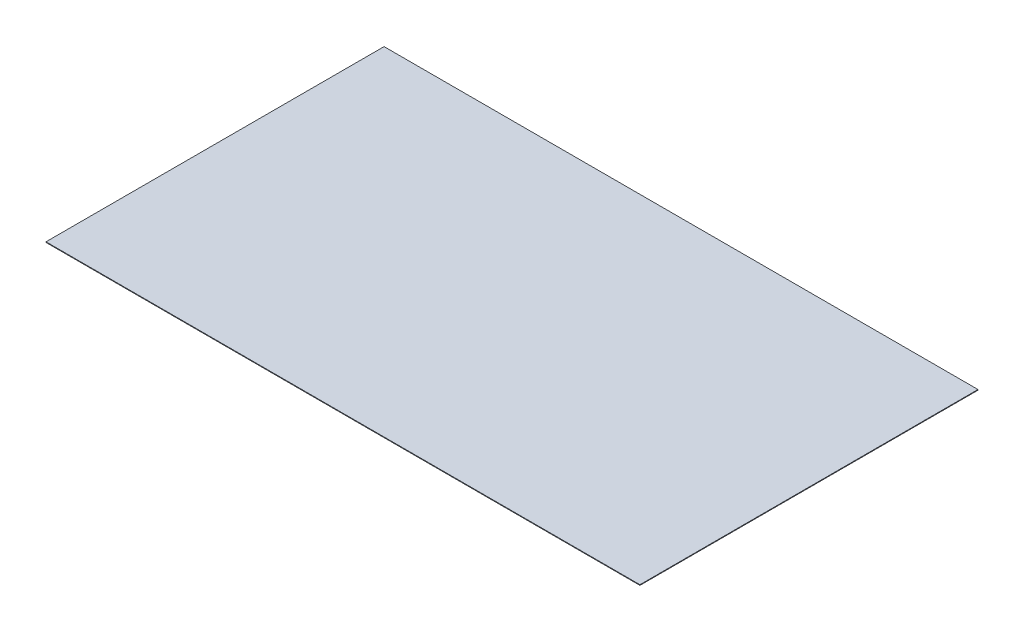
from build123d import *

# Parameters (mm, degrees)
CROQUIS1_W     = 1939.5
CROQUIS1_H     = 1104
EXTRUIR1_DEPTH = 2


with BuildPart() as part:
    # Croquis1 → Extruir1 (new body)
    with BuildSketch(Plane(origin=(0, 0, 0), x_dir=(1, 0, 0), z_dir=(0, 1, 0))):
        Rectangle(CROQUIS1_W, CROQUIS1_H)
    extrude(amount=EXTRUIR1_DEPTH)


solid = part.part
